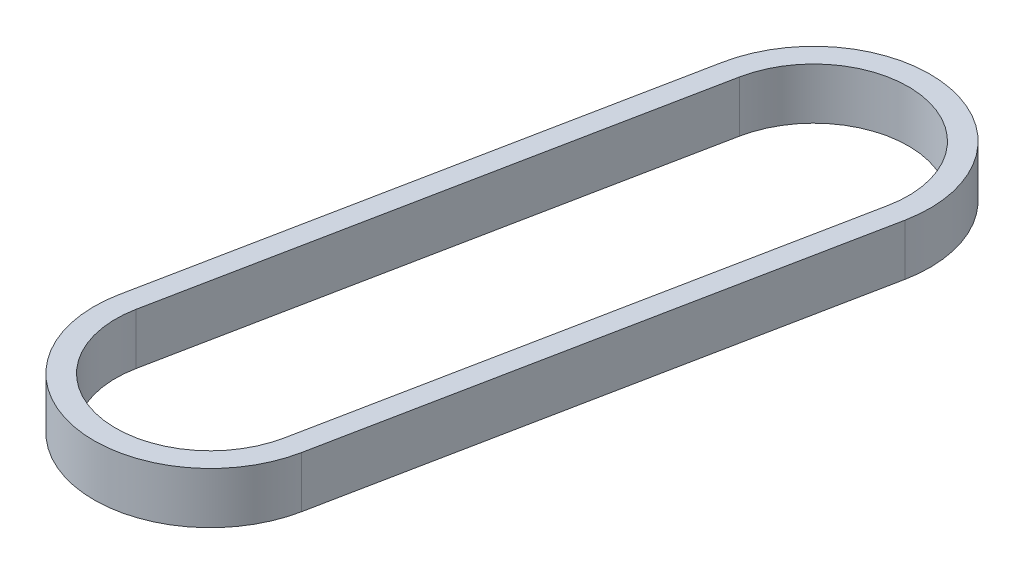
from build123d import *

# Parameters (mm, degrees)
BOSS_EXTRUDE1_DEPTH = 4.5


with BuildPart() as part:
    # Sketch1 → Boss-Extrude1 (new, symmetric)
    with BuildSketch(Plane(origin=(0, 254.392577481, 0), x_dir=(1, 0, 0), z_dir=(0, 1, 0))):
        with BuildLine():
            Line((25.484273554, -181.693777747), (7.854508283, -269.943103479))
            ThreePointArc((7.854508283, -269.943103479), (-16.146601218, -285.951437018), (-32.154934757, -261.950327517))
            Line((-32.154934757, -261.950327517), (-14.525169486, -173.701001785))
            ThreePointArc((-14.525169486, -173.701001785), (9.475940015, -157.692668245), (25.484273554, -181.693777747))
        make_face()
        with BuildLine():
            ThreePointArc((21.757903859, -180.949352535), (8.731514803, -161.41903794), (-10.798799791, -174.445426997))
            Line((-10.798799791, -174.445426997), (-28.428565062, -262.694752729))
            ThreePointArc((-28.428565062, -262.694752729), (-15.402176006, -282.225067323), (4.128138588, -269.198678267))
            Line((4.128138588, -269.198678267), (21.757903859, -180.949352535))
        make_face(mode=Mode.SUBTRACT)
    extrude(amount=BOSS_EXTRUDE1_DEPTH, both=True)


solid = part.part
